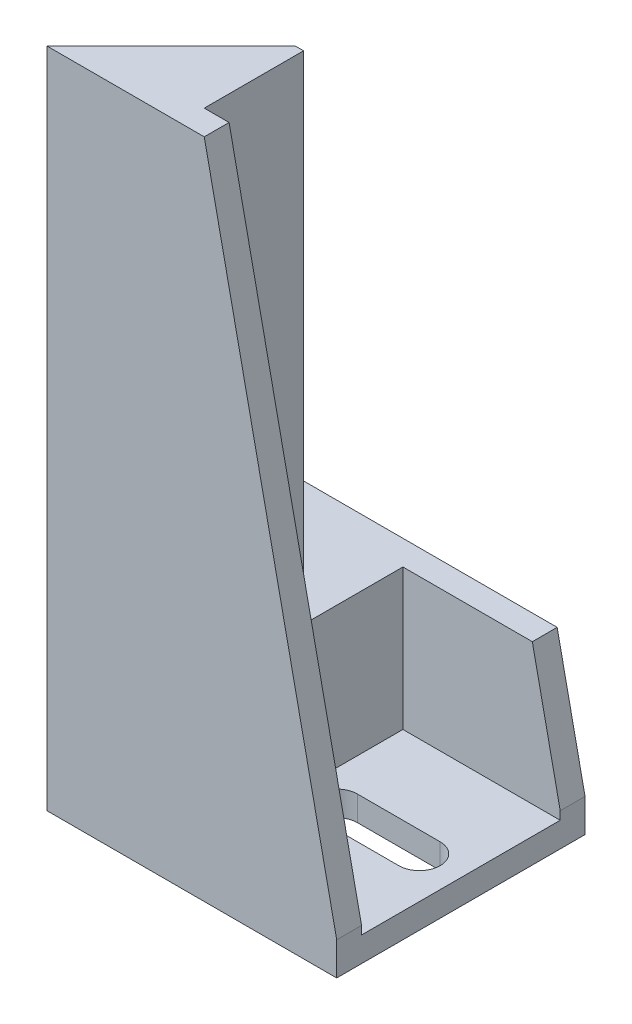
from build123d import *

# Parameters (mm, degrees)
BOSS_EXTRUDE1_DEPTH = 38.1
SHELL1_T            = -3.81
CUT_EXTRUDE1_DEPTH  = 3.81
BOSS_EXTRUDE2_DEPTH = 101.6
SKETCH5_W           = 24.13
SKETCH5_H           = 30.48
CUT_EXTRUDE2_DEPTH  = 97.79
BOSS_EXTRUDE3_DEPTH = 25.4
SKETCH9_W           = 44.45
SKETCH9_H           = 19.05
CUT_EXTRUDE4_DEPTH  = 76.2


with BuildPart() as part:
    # Sketch1 → Boss-Extrude1 (new body)
    with BuildSketch(Plane.XY):
        Polygon((0, 0), (25.4, 0), (25.4, 5.08), (5.08, 101.6), (0, 101.6), align=None)
    extrude(amount=BOSS_EXTRUDE1_DEPTH)

    # Shell1
    shell1_openings = [part.faces().sort_by_distance(p)[0] for p in [
        (15.24, 53.34, 19.05),
    ]]
    offset(amount=SHELL1_T, openings=shell1_openings, kind=Kind.INTERSECTION)

    # Sketch2 → Cut-Extrude1 (cut)
    with BuildSketch(Plane.XZ):
        with BuildLine():
            Line((6.35, 22.225), (19.05, 22.225))
            ThreePointArc((19.05, 22.225), (22.225, 19.05), (19.05, 15.875))
            Line((19.05, 15.875), (6.35, 15.875))
            ThreePointArc((6.35, 15.875), (3.175, 19.05), (6.35, 22.225))
        make_face()
    extrude(amount=-CUT_EXTRUDE1_DEPTH, mode=Mode.SUBTRACT)

    # Sketch3 → Boss-Extrude2 (add)
    with BuildSketch(Plane(origin=(0, 101.6, 0), x_dir=(1, 0, 0), z_dir=(0, 1, 0))):
        Polygon((-19.05, 0), (0, -19.05), (0, 0), align=None)
        Polygon((0, -38.1), (0, -19.05), (-19.05, -38.1), align=None)
    extrude(amount=-BOSS_EXTRUDE2_DEPTH)

    # Sketch5 → Cut-Extrude2 (cut)
    with BuildSketch(Plane(origin=(0, 101.6, 0), x_dir=(1, 0, 0), z_dir=(0, 1, 0))):
        with Locations((13.335, -19.05)):
            Rectangle(SKETCH5_W, SKETCH5_H)
    extrude(amount=-CUT_EXTRUDE2_DEPTH, mode=Mode.SUBTRACT)

    # Sketch6 → Boss-Extrude3 (add)
    with BuildSketch(Plane.XZ):
        Polygon((-19.05, 0), (0, 19.05), (-19.05, 38.1), align=None)
    extrude(amount=-BOSS_EXTRUDE3_DEPTH)

    # Sketch9 → Cut-Extrude4 (cut)
    with BuildSketch(Plane(origin=(0, 101.6, 0), x_dir=(1, 0, 0), z_dir=(0, 1, 0))):
        with Locations((3.175, -9.525)):
            Rectangle(SKETCH9_W, SKETCH9_H)
    extrude(amount=-CUT_EXTRUDE4_DEPTH, mode=Mode.SUBTRACT)


solid = part.part
